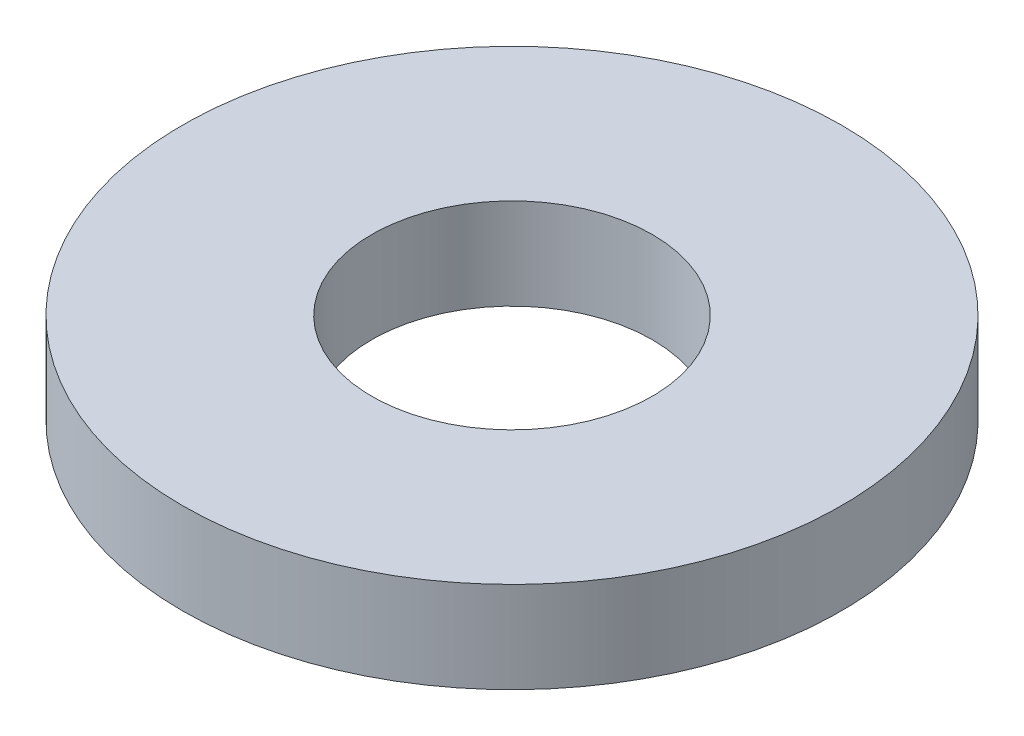
from build123d import *

# Parameters (mm, degrees)
SKETCH_1_R      = 23.5
SKETCH_1_R_2    = 10
EXTRUDE_1_DEPTH = 6.5


with BuildPart() as part:
    # 草图1 → 凸台-拉伸1 (new body)
    with BuildSketch(Plane(origin=(0, 0, 0), x_dir=(1, 0, 0), z_dir=(0, 1, 0))):
        with Locations(Location((0, 0, 0), (0, 0, 90))):
            Circle(SKETCH_1_R)
        with Locations(Location((0, 0, 0), (0, 0, 90))):
            Circle(SKETCH_1_R_2, mode=Mode.SUBTRACT)
    extrude(amount=EXTRUDE_1_DEPTH)


solid = part.part
